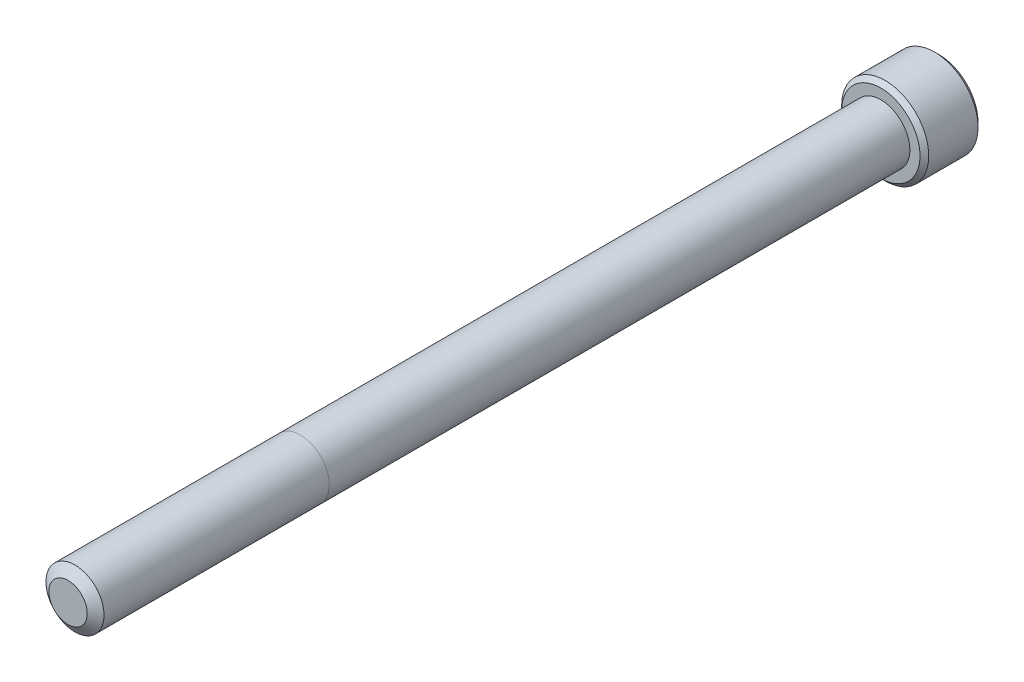
from build123d import *

# Parameters (mm, degrees)
SKETCH1_R          = 3.175
EXTRUDE1_DEPTH     = 88.9
SKETCH6_R          = 4.7625
EXTRUDE2_DEPTH     = 6.35
CUT_EXTRUDE1_DEPTH = 3.571875
CHAMFER1_SIZE      = 0.47625


with BuildPart() as part:
    # Sketch1 → Extrude1 (new body)
    with BuildSketch(Plane.XY):
        Circle(SKETCH1_R)
    extrude(amount=-EXTRUDE1_DEPTH)

    # Sketch4 → Cut-Revolve1 (revolve, cut)
    with BuildSketch(Plane(origin=(0, 0, 0), x_dir=(0, 0, -1), z_dir=(1, 0, 0))):
        Polygon((0.755446349, 3.175), (0, 2.096110803), (0, 3.175), align=None)
    revolve(axis=Axis((0, 0, 0), (0, 0, -1)), mode=Mode.SUBTRACT)

    # Sketch6 → Extrude2 (add)
    with BuildSketch(Plane(origin=(0, 0, -88.9), x_dir=(-1, 0, 0), z_dir=(0, 0, -1))):
        Circle(SKETCH6_R)
    extrude(amount=EXTRUDE2_DEPTH)

    # Sketch7 → Cut-Extrude1 (cut)
    with BuildSketch(Plane(origin=(0, 0, -95.25), x_dir=(-1, 0, 0), z_dir=(0, 0, -1))):
        Polygon((0, 2.749630657), (-2.38125, 1.374815329), (-2.38125, -1.374815329), (0, -2.749630657), (2.38125, -1.374815329), (2.38125, 1.374815329), align=None)
    extrude(amount=-CUT_EXTRUDE1_DEPTH, mode=Mode.SUBTRACT)

    # Cut-Extrude2 cone 1 section (through the dimple's axis) → Cut-Extrude2 (revolve, cut)
    with BuildSketch(Plane(origin=(0, 0, -95.25), x_dir=(0, 1, 0), z_dir=(1, 0, 0))):
        Polygon((0, 0), (2.749630657, 0), (0, 2.749630657), align=None)
    revolve(axis=Axis((0, 0, -95.25), (0, 0, 1)), mode=Mode.SUBTRACT)

    # Chamfer1
    chamfer1_edges = [part.edges().sort_by_distance(p)[0] for p in [
        (4.7625, 0, -95.25),
        (4.7625, 0, -88.9),
    ]]
    chamfer(chamfer1_edges, length=CHAMFER1_SIZE)


solid = part.part
